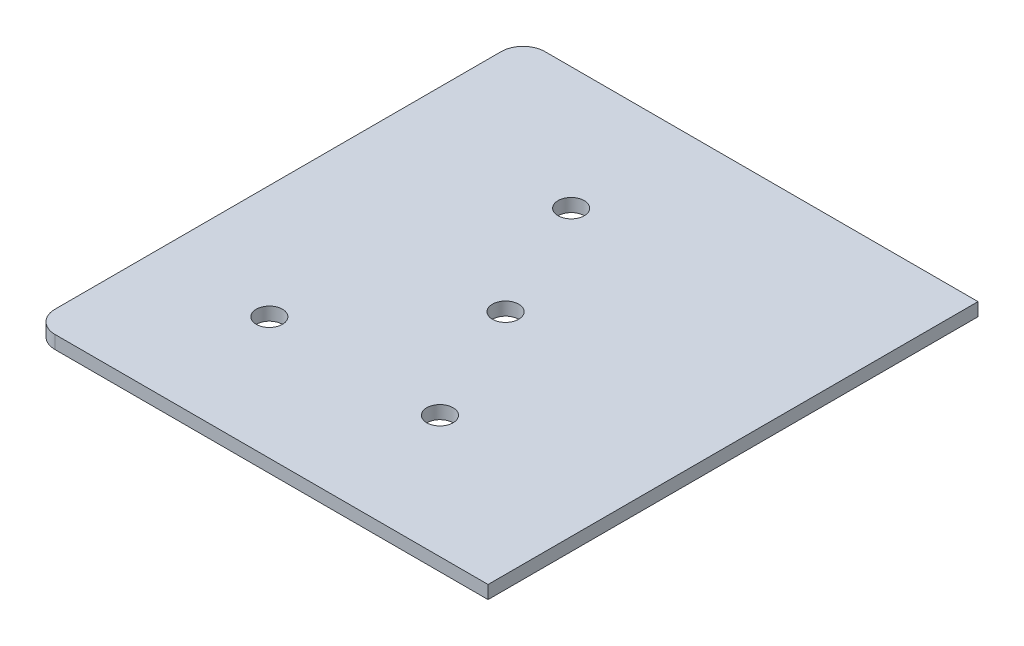
from build123d import *

# Parameters (mm, degrees)
BOSS_EXTRUDE1_DEPTH = 9.525
BOSS_EXTRUDE2_DEPTH = 9.525
SKETCH3_R           = 9.525
CUT_EXTRUDE6_DEPTH  = 587.481888574
FILLET1_R           = 15.875


with BuildPart() as part:
    # Sketch1 → Boss-Extrude1 (new body)
    with BuildSketch(Plane(origin=(0, 0, 0), x_dir=(1, 0, 0), z_dir=(0, 1, 0))):
        Polygon((461.512355724, 17.636671785), (558.8, 99.270698215), (558.8, 177.8), (228.6, 177.8), (228.6, -177.8), align=None)
    extrude(amount=BOSS_EXTRUDE1_DEPTH)

    # Sketch1<4> → Boss-Extrude2 (add)
    with BuildSketch(Plane(origin=(0, 0, 0), x_dir=(1, 0, 0), z_dir=(0, 1, 0))):
        Polygon((558.8, -177.8), (558.8, 99.270698215), (461.512355724, 17.636671785), (228.6, -177.8), align=None)
    extrude(amount=BOSS_EXTRUDE2_DEPTH)

    # Sketch3 → Cut-Extrude6 (cut, through all)
    with BuildSketch(Plane.XZ):
        with Locations((393.7, 0)):
            Circle(SKETCH3_R)
        with Locations((352.425, -88.9)):
            Circle(SKETCH3_R)
        with Locations((311.15, 88.9)):
            Circle(SKETCH3_R)
        with Locations((434.975, 88.9)):
            Circle(SKETCH3_R)
    extrude(amount=-CUT_EXTRUDE6_DEPTH, mode=Mode.SUBTRACT)

    # Fillet1
    fillet1_edges = [part.edges().sort_by_distance(p)[0] for p in [
        (228.6, 4.7625, 177.8),
        (228.6, 4.7625, -177.8),
    ]]
    fillet(fillet1_edges, radius=FILLET1_R)


solid = part.part
